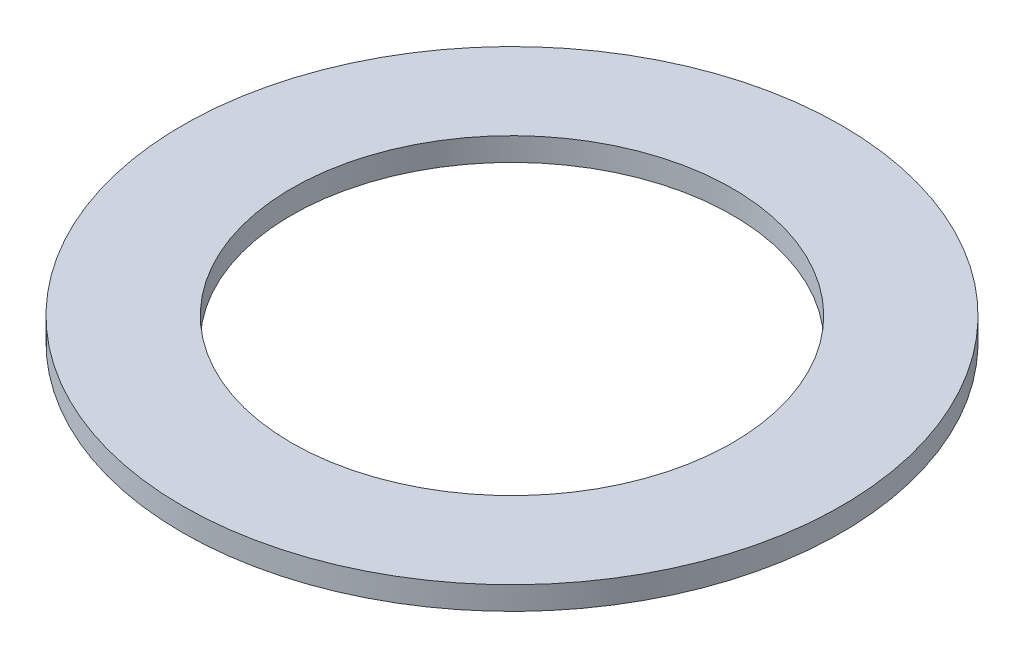
from build123d import *

# Parameters (mm, degrees)
SKETCH1_R           = 28.575
SKETCH1_R_2         = 19.1135
BOSS_EXTRUDE1_DEPTH = 2.0066


with BuildPart() as part:
    # Sketch1 → Boss-Extrude1 (new body)
    with BuildSketch(Plane(origin=(0, 0, 0), x_dir=(1, 0, 0), z_dir=(0, 1, 0))):
        Circle(SKETCH1_R)
        Circle(SKETCH1_R_2, mode=Mode.SUBTRACT)
    extrude(amount=BOSS_EXTRUDE1_DEPTH)


solid = part.part
